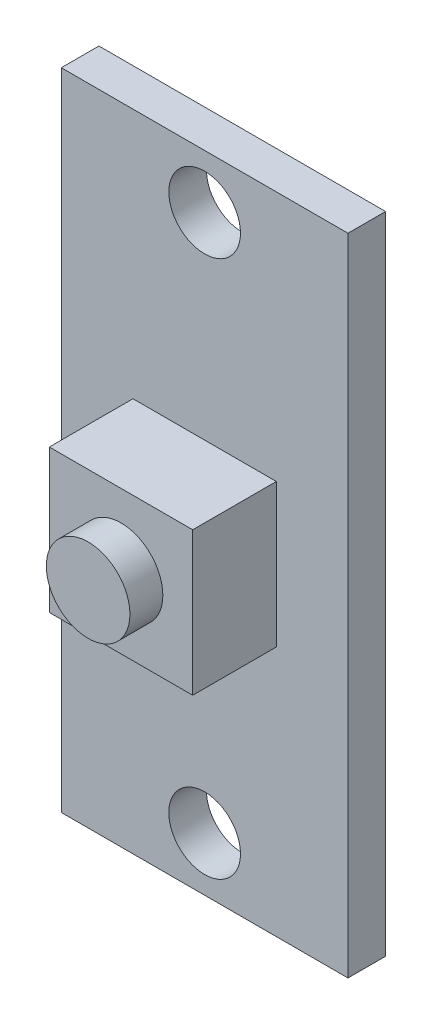
from build123d import *

# Parameters (mm, degrees)
SKETCH1_W               = 12.192
SKETCH1_H               = 27.432
BOSS_EXTRUDE1_DEPTH     = 1.6002
SKETCH2_W               = 6.096
SKETCH2_H               = 6.096
BOSS_EXTRUDE2_DEPTH     = 3.556
CUT_EXTRUDE1_DEPTH      = 16.425142074
CUT_EXTRUDE1_DEPTH_BACK = 16.425142074
SKETCH4_R               = 1.524
SKETCH5_R               = 1.778
BOSS_EXTRUDE3_DEPTH     = 1.39954


with BuildPart() as part:
    # Sketch1 → Boss-Extrude1 (new body)
    with BuildSketch(Plane.XY):
        Rectangle(SKETCH1_W, SKETCH1_H)
    extrude(amount=BOSS_EXTRUDE1_DEPTH)

    # Sketch2 → Boss-Extrude2 (add)
    with BuildSketch(Plane.XY.offset(1.6002)):
        Rectangle(SKETCH2_W, SKETCH2_H)
    extrude(amount=BOSS_EXTRUDE2_DEPTH)

    # Sketch4 → Cut-Extrude1 (cut, two sides: drawn at the far end of the back side and taken through both)
    with BuildSketch(Plane.XY.offset(1.6002).offset(-CUT_EXTRUDE1_DEPTH_BACK)):
        with Locations((0, 11.43)):
            Circle(SKETCH4_R)
        with Locations((0, -11.43)):
            Circle(SKETCH4_R)
    extrude(amount=CUT_EXTRUDE1_DEPTH + CUT_EXTRUDE1_DEPTH_BACK, mode=Mode.SUBTRACT)

    # Sketch5 → Boss-Extrude3 (add)
    with BuildSketch(Plane.XY.offset(5.1562)):
        Circle(SKETCH5_R)
    extrude(amount=BOSS_EXTRUDE3_DEPTH)


solid = part.part
